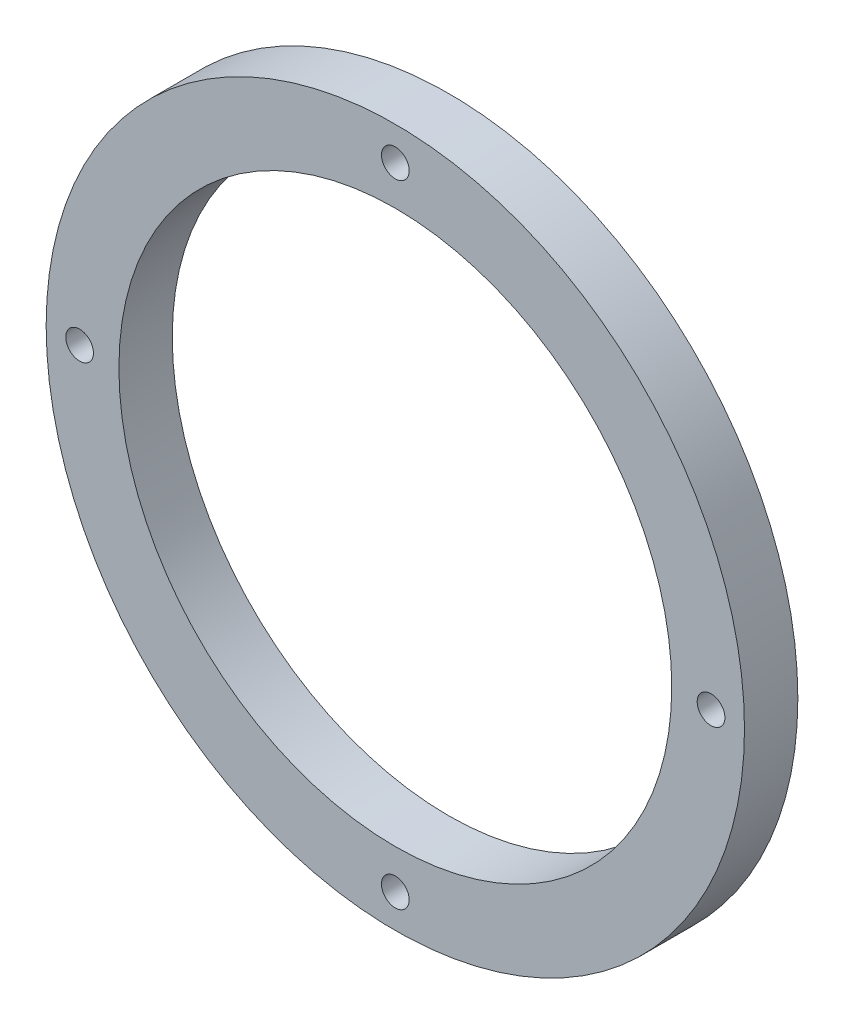
from build123d import *

# Parameters (mm, degrees)
SKETCH1_R           = 60
SKETCH1_R_2         = 47.5
SKETCH1_R_3         = 2.38125
BOSS_EXTRUDE1_DEPTH = 9.1694


with BuildPart() as part:
    # Sketch1 → Boss-Extrude1 (new body)
    with BuildSketch(Plane.XY):
        Circle(SKETCH1_R)
        Circle(SKETCH1_R_2, mode=Mode.SUBTRACT)
        with Locations((0, 54.25)):
            Circle(SKETCH1_R_3, mode=Mode.SUBTRACT)
        with Locations((54.25, 0)):
            Circle(SKETCH1_R_3, mode=Mode.SUBTRACT)
        with Locations((0, -54.25)):
            Circle(SKETCH1_R_3, mode=Mode.SUBTRACT)
        with Locations((-54.25, 0)):
            Circle(SKETCH1_R_3, mode=Mode.SUBTRACT)
    extrude(amount=BOSS_EXTRUDE1_DEPTH)


solid = part.part
